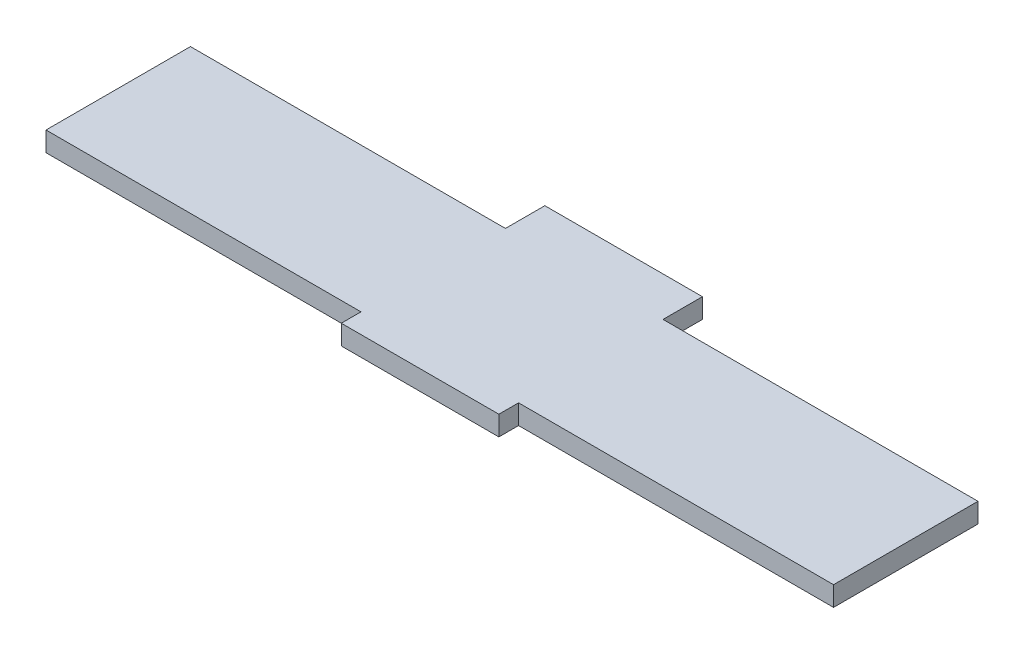
from build123d import *

# Parameters (mm, degrees)
SKETCH1_W           = 24
SKETCH1_H           = 3
SKETCH1_W_2         = 119.935446049
SKETCH1_H_2         = 22
SKETCH1_H_3         = 6
BOSS_EXTRUDE1_DEPTH = 3


with BuildPart() as part:
    # Sketch1 → Boss-Extrude1 (new body)
    with BuildSketch(Plane(origin=(0, 0, 0), x_dir=(1, 0, 0), z_dir=(0, 1, 0))):
        with Locations((-59.967723024, -1.5)):
            Rectangle(SKETCH1_W, SKETCH1_H)
        with Locations((-59.967723025, 11)):
            Rectangle(SKETCH1_W_2, SKETCH1_H_2)
        with Locations((-59.967723024, 25)):
            Rectangle(SKETCH1_W, SKETCH1_H_3)
    extrude(amount=BOSS_EXTRUDE1_DEPTH)


solid = part.part
